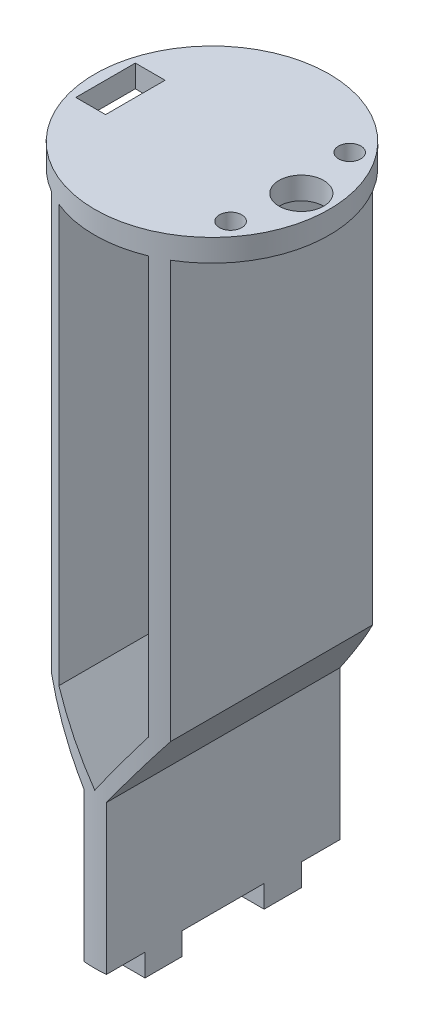
from build123d import *

# Parameters (mm, degrees)
BOSS_EXTRU_1_DEPTH                   = 33
ESQUISSE3_R                          = 16.5
BOSS_EXTRU_2_DEPTH                   = 3
ESQUISSE4_R                          = 3
ESQUISSE4_R_2                        = 1.5
ENL_V_MAT_EXTRU_1_DEPTH              = 94.202215967
ESQUISSE5_W                          = 3
ESQUISSE5_H                          = 5
BOSS_EXTRU_3_DEPTH                   = 3
ENL_V_DE_MAT_EXTRU_MINCE2_DEPTH      = 30
ENL_V_DE_MAT_EXTRU_MINCE2_DEPTH_BACK = 90
ESQUISSE2_R                          = 35.75
ESQUISSE2_R_2                        = 15.75


with BuildPart() as part:
    # Esquisse1 → Boss.-Extru.1 (new body)
    with BuildSketch(Plane.XY):
        Polygon((3, 0), (9.5, 9.285714286), (9.5, 68.285714286), (-6.5, 68.285714286), (-6.5, 9.285714286), (0, 0), (0, -20), (3, -20), align=None)
        Polygon((7.5, 9.285714286), (7.5, 65.285714286), (-4.5, 65.285714286), (-4.5, 9.285714286), (1.5, 0.714285714), align=None, mode=Mode.SUBTRACT)
    extrude(amount=BOSS_EXTRU_1_DEPTH)

    # Esquisse3 → Boss.-Extru.2 (add)
    with BuildSketch(Plane(origin=(0, 68.285714286, 0), x_dir=(1, 0, 0), z_dir=(0, 1, 0))):
        with Locations((1.5, -16.5)):
            Circle(ESQUISSE3_R)
    extrude(amount=-BOSS_EXTRU_2_DEPTH)

    # Esquisse4 → Enlèv. mat.-Extru.1 (cut, through all)
    with BuildSketch(Plane.XZ.offset(-65.285714286)):
        with Locations(Location((13.5, 16.5, 0), (0, 0, 270))):
            Circle(ESQUISSE4_R)
        with Locations(Location((12, 8.5, 0), (0, 0, 270))):
            Circle(ESQUISSE4_R_2)
        with Locations(Location((12, 24.5, 0), (0, 0, 90))):
            Circle(ESQUISSE4_R_2)
        Polygon((-12.8, 16.5), (-12.8, 20.5), (-8.8, 20.5), (-8.8, 12.5), (-12.8, 12.5), align=None)
    extrude(amount=-ENL_V_MAT_EXTRU_1_DEPTH, mode=Mode.SUBTRACT)

    # Esquisse5 → Boss.-Extru.3 (add)
    with BuildSketch(Plane.XZ.offset(20)):
        with Locations((1.5, 24.5)):
            Rectangle(ESQUISSE5_W, ESQUISSE5_H)
        with Locations((1.5, 8.5)):
            Rectangle(ESQUISSE5_W, ESQUISSE5_H)
    extrude(amount=BOSS_EXTRU_3_DEPTH)

    # Esquisse2 → Enlèv. de mat.-Extru.-Mince2 (cut, two sides: drawn at the far end of the back side and taken through both)
    with BuildSketch(Plane(origin=(0, 68.285714286, 0), x_dir=(1, 0, 0), z_dir=(0, 1, 0)).offset(-ENL_V_DE_MAT_EXTRU_MINCE2_DEPTH_BACK)):
        with Locations((1.5, -16.5)):
            Circle(ESQUISSE2_R)
        with Locations((1.5, -16.5)):
            Circle(ESQUISSE2_R_2, mode=Mode.SUBTRACT)
    extrude(amount=ENL_V_DE_MAT_EXTRU_MINCE2_DEPTH + ENL_V_DE_MAT_EXTRU_MINCE2_DEPTH_BACK, mode=Mode.SUBTRACT)


solid = part.part
